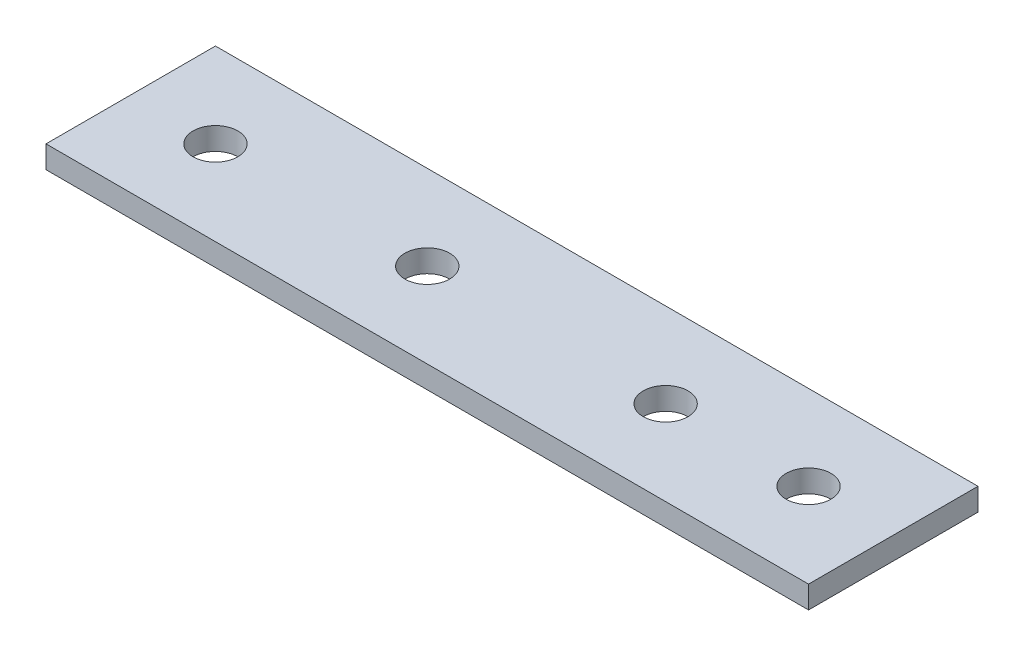
from build123d import *

# Parameters (mm, degrees)
SKETCH1_W           = 54
SKETCH1_H           = 12
SKETCH1_R           = 1.5875
BOSS_EXTRUDE1_DEPTH = 0.79375


with BuildPart() as part:
    # Sketch1 → Boss-Extrude1 (new, symmetric)
    with BuildSketch(Plane(origin=(0, 0, 0), x_dir=(1, 0, 0), z_dir=(0, 1, 0))):
        Rectangle(SKETCH1_W, SKETCH1_H)
        with Locations(Location((-21, 0, 0), (0, 0, 270))):
            Circle(SKETCH1_R, mode=Mode.SUBTRACT)
        with Locations(Location((21, 0, 0), (0, 0, 270))):
            Circle(SKETCH1_R, mode=Mode.SUBTRACT)
        with Locations(Location((-6, 0, 0), (0, 0, 270))):
            Circle(SKETCH1_R, mode=Mode.SUBTRACT)
        with Locations(Location((10.88, 0, 0), (0, 0, 270))):
            Circle(SKETCH1_R, mode=Mode.SUBTRACT)
    extrude(amount=BOSS_EXTRUDE1_DEPTH, both=True)


solid = part.part
